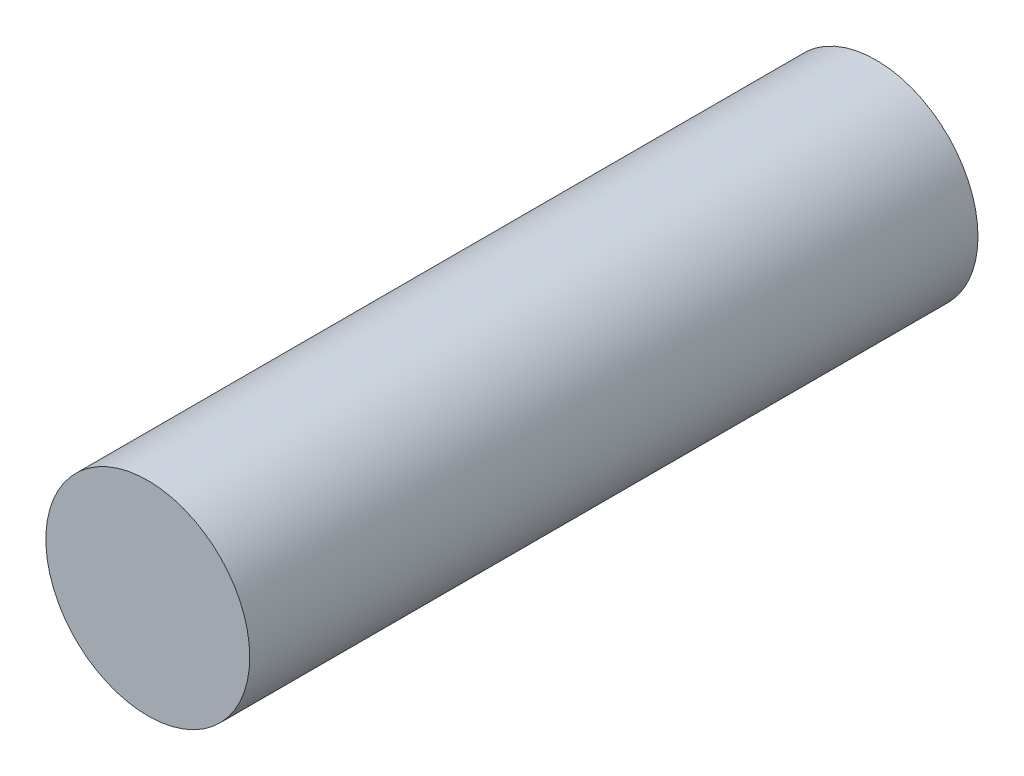
from build123d import *

# Parameters (mm, degrees)
FKAP_MENTESE_MOTORU_D28_START = 40
SKETCH1_R                     = 14
FKAP_MENTESE_MOTORU_D28_DEPTH = 100


with BuildPart() as part:
    # Sketch1 → FKAP_mentese_motoru_D28 (new body)
    with BuildSketch(Plane.XY.offset(FKAP_MENTESE_MOTORU_D28_START)):
        with Locations((655, 14)):
            Circle(SKETCH1_R)
    extrude(amount=-FKAP_MENTESE_MOTORU_D28_DEPTH)


solid = part.part
